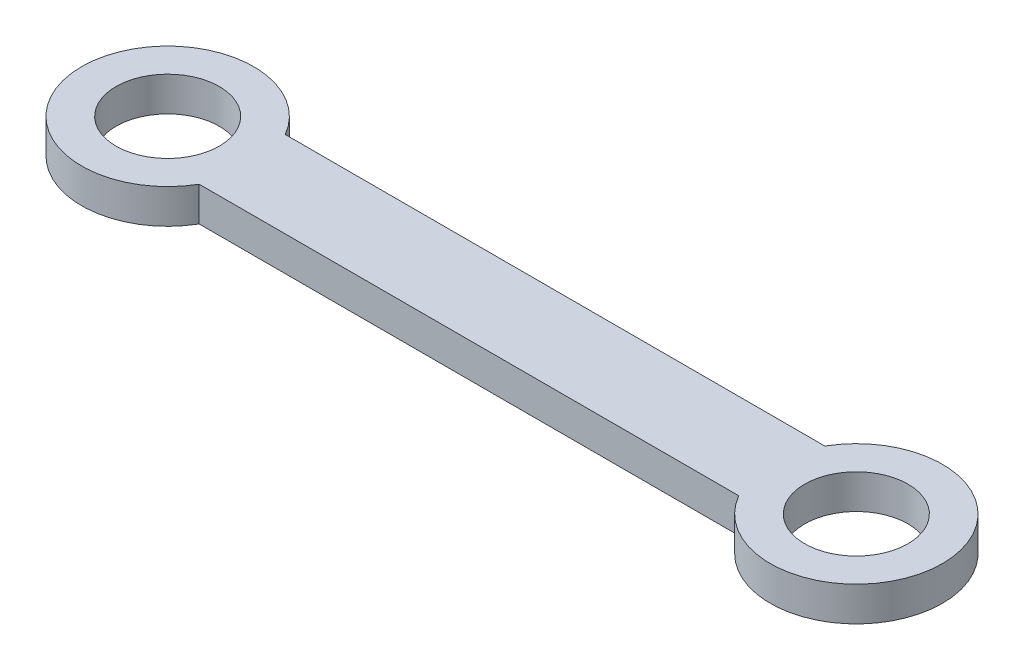
from build123d import *

# Parameters (mm, degrees)
SKETCH1_R           = 3
BOSS_EXTRUDE1_DEPTH = 2


with BuildPart() as part:
    # Sketch1 → Boss-Extrude1 (new body)
    with BuildSketch(Plane(origin=(0, 0, 0), x_dir=(1, 0, 0), z_dir=(0, 1, 0))):
        with BuildLine():
            Line((15.669872981, -2.5), (-15.669872981, -2.5))
            ThreePointArc((-15.669872981, -2.5), (-25, 0), (-15.669872981, 2.5))
            Line((-15.669872981, 2.5), (15.669872981, 2.5))
            ThreePointArc((15.669872981, 2.5), (25, 0), (15.669872981, -2.5))
        make_face()
        with Locations(Location((-20, 0, 0), (0, 0, 270))):
            Circle(SKETCH1_R, mode=Mode.SUBTRACT)
        with Locations(Location((20, 0, 0), (0, 0, 90))):
            Circle(SKETCH1_R, mode=Mode.SUBTRACT)
    extrude(amount=BOSS_EXTRUDE1_DEPTH)


solid = part.part
